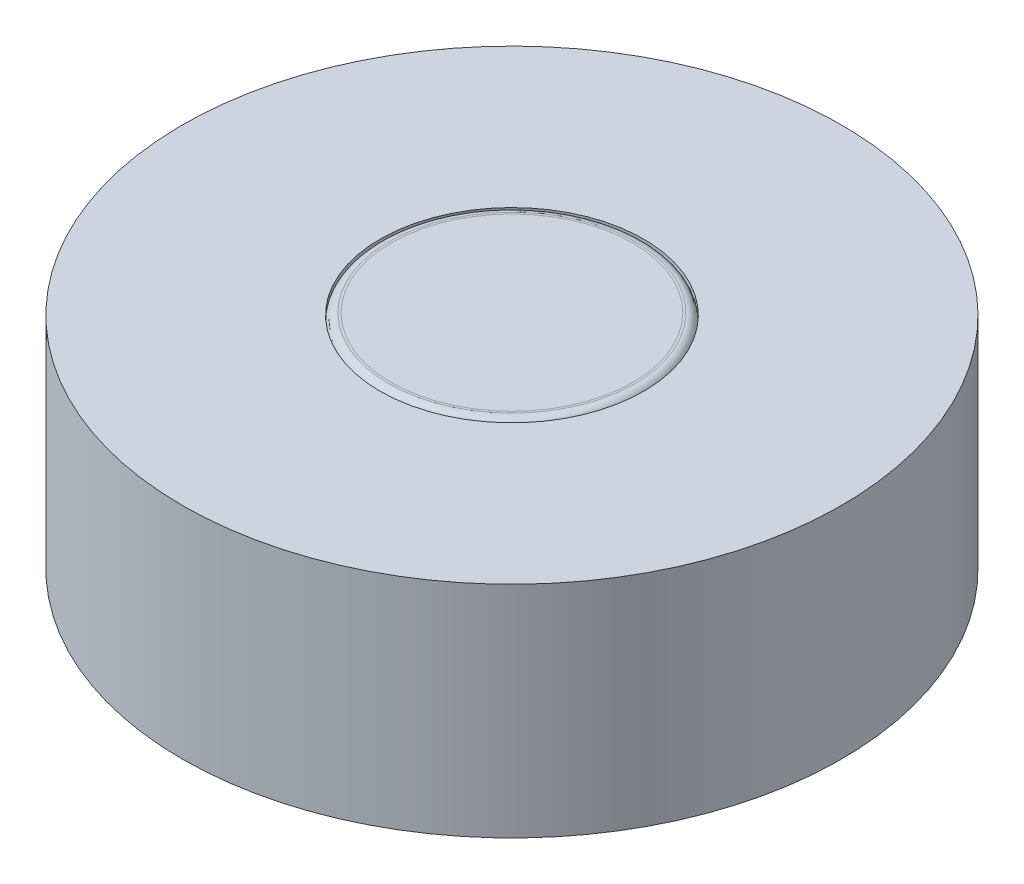
from build123d import *

# Parameters (mm, degrees)
SKETCH1_R           = 15
SKETCH1_R_2         = 6
BOSS_EXTRUDE1_DEPTH = 10
SKETCH2_R           = 6
SKETCH2_R_2         = 5.5
BOSS_EXTRUDE2_DEPTH = 10.1
FILLET1_R           = 0.4
SKETCH3_R           = 5.5
BOSS_EXTRUDE3_DEPTH = 0.1


with BuildPart() as part:
    # Sketch1 → Boss-Extrude1 (new body)
    with BuildSketch(Plane(origin=(0, 0, 0), x_dir=(1, 0, 0), z_dir=(0, 1, 0))):
        with Locations(Location((0, 0, 0), (0, 0, 270))):
            Circle(SKETCH1_R)
        with Locations(Location((0, 0, 0), (0, 0, 270))):
            Circle(SKETCH1_R_2, mode=Mode.SUBTRACT)
    extrude(amount=BOSS_EXTRUDE1_DEPTH)


with BuildPart() as body_2:
    # Sketch2 → Boss-Extrude2 (new body)
    with BuildSketch(Plane(origin=(0, 0, 0), x_dir=(1, 0, 0), z_dir=(0, 1, 0))):
        with Locations(Location((0, 0, 0), (0, 0, 270))):
            Circle(SKETCH2_R)
        with Locations(Location((0, 0, 0), (0, 0, 270))):
            Circle(SKETCH2_R_2, mode=Mode.SUBTRACT)
    extrude(amount=BOSS_EXTRUDE2_DEPTH)

    # Fillet1
    fillet1_edges = [body_2.edges().sort_by_distance(p)[0] for p in [
        (0, 10.1, -6),
    ]]
    fillet(fillet1_edges, radius=FILLET1_R)


with BuildPart() as body_3:
    # Sketch3 → Boss-Extrude3 (new body)
    with BuildSketch(Plane(origin=(0, 10, 0), x_dir=(1, 0, 0), z_dir=(0, 1, 0))):
        with Locations(Location((0, 0, 0), (0, 0, 270))):
            Circle(SKETCH3_R)
    extrude(amount=BOSS_EXTRUDE3_DEPTH)


solid = Compound([part.part, body_2.part, body_3.part])
